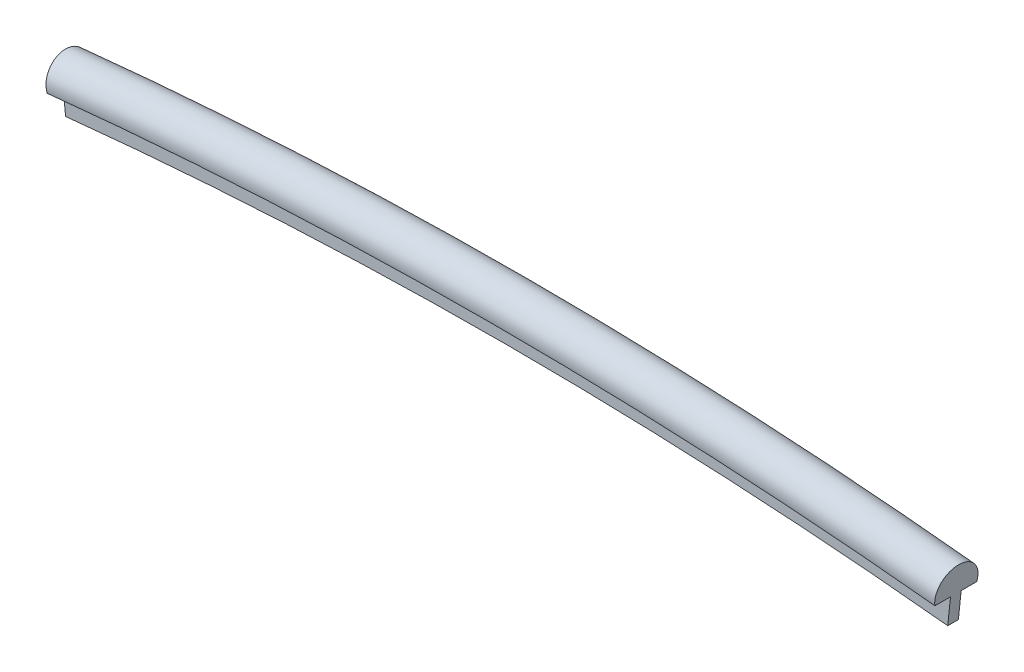
from build123d import *

# Parameters (mm, degrees)
REVOLVE1_ANGLE           = 5.949220755
REVOLVE1_OTHER_WAY_ANGLE = 5.949220755


with BuildPart() as part:
    # Sketch2 → Revolve1 (revolve)
    with BuildSketch(Plane(origin=(0, 0, 0), x_dir=(0, 0, -1), z_dir=(1, 0, 0))):
        with BuildLine():
            Line((0, 239.8), (0.3, 239.8))
            Line((0.3, 239.8), (0.3, 241.3))
            Line((0.3, 241.3), (1.18, 241.3))
            ThreePointArc((1.18, 241.3), (0, 242.800182019), (-1.18, 241.3))
            Line((-1.18, 241.3), (-0.3, 241.3))
            Line((-0.3, 241.3), (-0.3, 239.8))
            Line((-0.3, 239.8), (0, 239.8))
        make_face()
    revolve(axis=Axis((0, 0, 70.597641597), (0, 0, -1)), revolution_arc=REVOLVE1_ANGLE)

    # Sketch2 → Revolve1 other way (revolve)
    with BuildSketch(Plane(origin=(0, 0, 0), x_dir=(0, 0, -1), z_dir=(1, 0, 0))):
        with BuildLine():
            Line((0, 239.8), (0.3, 239.8))
            Line((0.3, 239.8), (0.3, 241.3))
            Line((0.3, 241.3), (1.18, 241.3))
            ThreePointArc((1.18, 241.3), (0, 242.800182019), (-1.18, 241.3))
            Line((-1.18, 241.3), (-0.3, 241.3))
            Line((-0.3, 241.3), (-0.3, 239.8))
            Line((-0.3, 239.8), (0, 239.8))
        make_face()
    revolve(axis=Axis((0, 0, 70.597641597), (0, 0, 1)), revolution_arc=REVOLVE1_OTHER_WAY_ANGLE)


solid = part.part
